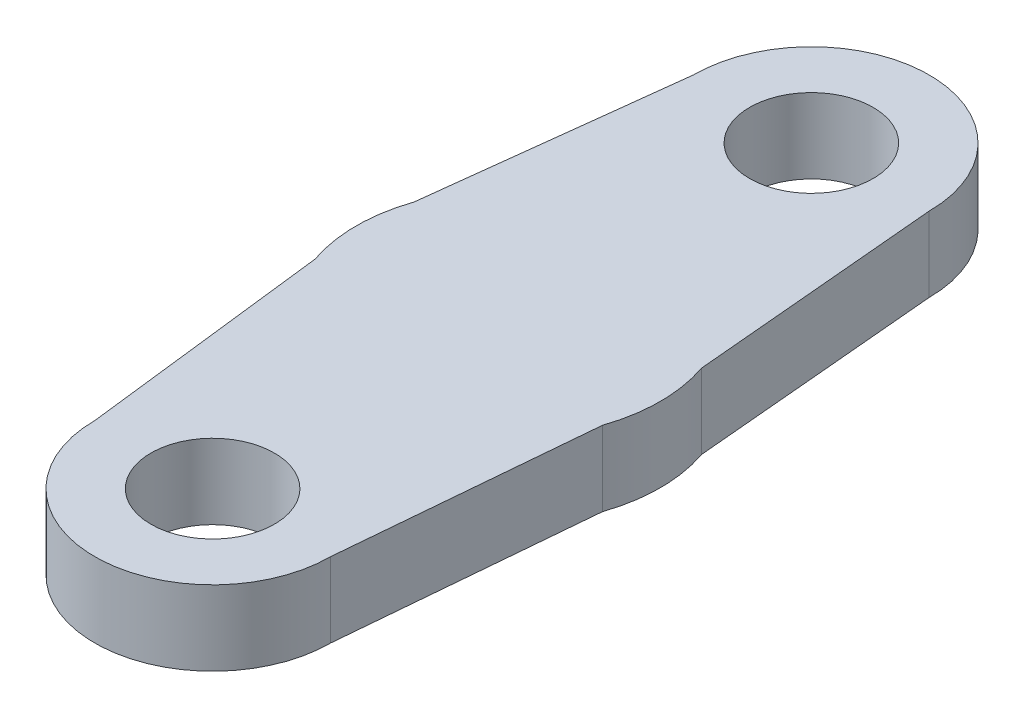
from build123d import *

# Parameters (mm, degrees)
CROQUIS1_R              = 1.65
SALIENTE_EXTRUIR1_DEPTH = 2


with BuildPart() as part:
    # Croquis1 → Saliente-Extruir1 (new body)
    with BuildSketch(Plane(origin=(0, 0, 0), x_dir=(1, 0, 0), z_dir=(0, 1, 0))):
        with BuildLine():
            Line((-3.05, 8), (-3.843136882, 1.320952577))
            ThreePointArc((-3.843136882, 1.320952577), (-4.063818008, 0), (-3.843136882, -1.320952577))
            Line((-3.843136882, -1.320952577), (-3.05, -8))
            ThreePointArc((-3.05, -8), (0.1, -11.15), (3.25, -8))
            Line((3.25, -8), (3.843136882, -1.320952577))
            ThreePointArc((3.843136882, -1.320952577), (4.063818008, 0), (3.843136882, 1.320952577))
            Line((3.843136882, 1.320952577), (3.25, 8))
            ThreePointArc((3.25, 8), (0.1, 11.15), (-3.05, 8))
        make_face()
        with Locations(Location((0.1, 8, 0), (0, 0, 270))):
            Circle(CROQUIS1_R, mode=Mode.SUBTRACT)
        with Locations(Location((0.1, -8, 0), (0, 0, 270))):
            Circle(CROQUIS1_R, mode=Mode.SUBTRACT)
    extrude(amount=SALIENTE_EXTRUIR1_DEPTH)


solid = part.part
